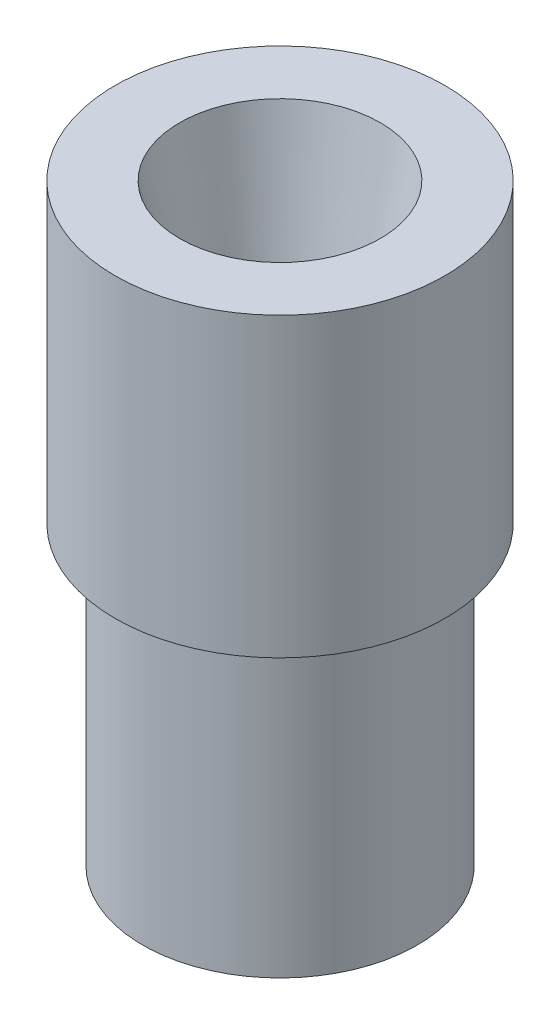
from build123d import *

# Parameters (mm, degrees)
SKETCH2_R          = 2.5
CUT_EXTRUDE1_DEPTH = 5
DRAFT1_ANGLE       = 10


with BuildPart() as part:
    # Sketch1 → Revolve1 (revolve)
    with BuildSketch(Plane.XY, mode=Mode.PRIVATE) as revolve1_sk:
        Polygon((0, 20), (5.55625, 20), (5.55625, 10), (4.625, 10), (4.625, 0), (0, 0), align=None)
    revolve(revolve1_sk.sketch.rotate(Axis((0, 0, 0), (0, 1, 0)), 90), axis=Axis((0, 0, 0), (0, 1, 0)))

    # Sketch2 → Cut-Extrude1 (cut)
    with BuildSketch(Plane(origin=(0, 20, 0), x_dir=(1, 0, 0), z_dir=(0, 1, 0))):
        with Locations(Location((0, 0, 0), (0, 0, 270))):
            Circle(SKETCH2_R)
    extrude(amount=-CUT_EXTRUDE1_DEPTH, mode=Mode.SUBTRACT)

    # Draft1
    draft1_faces = [part.faces().sort_by_distance(p)[0] for p in [
        (0, 17.5, -2.5),
    ]]
    draft(draft1_faces, Plane.ZX.offset(15), DRAFT1_ANGLE)


solid = part.part
